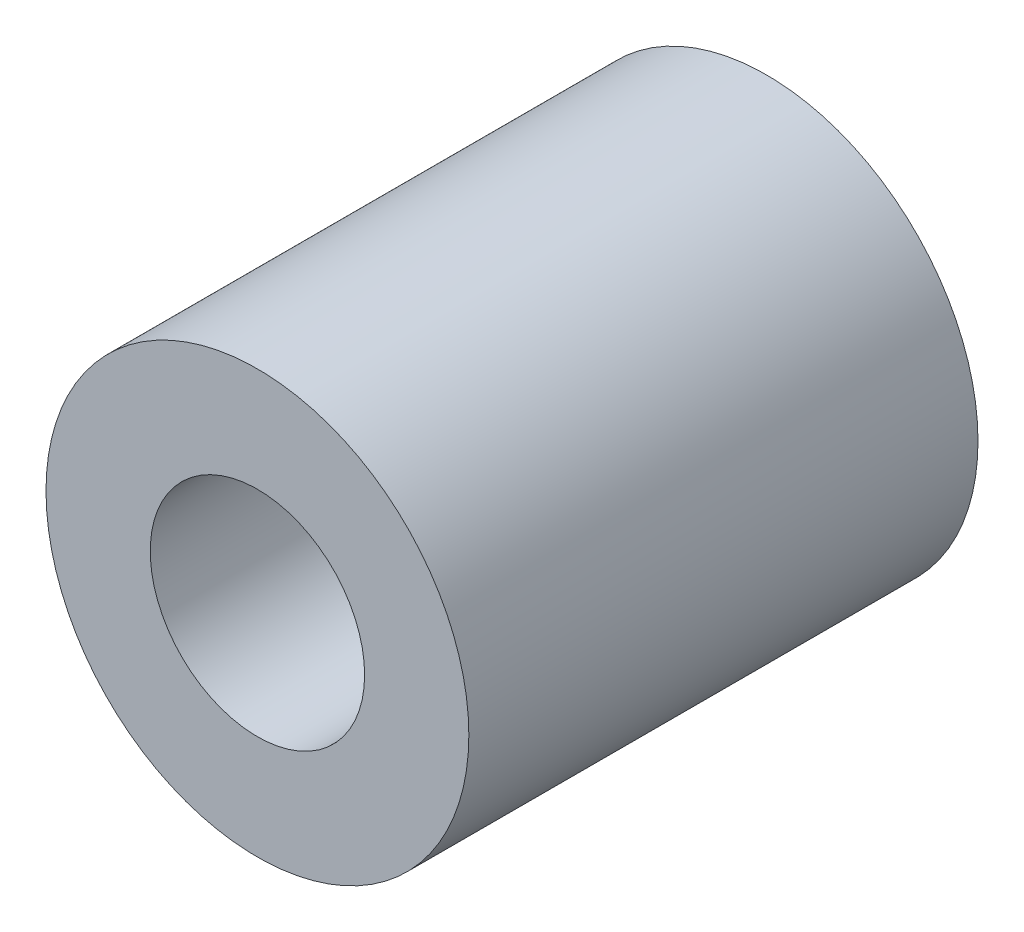
from build123d import *

# Parameters (mm, degrees)
ESQUISSE1_R        = 7.89
ESQUISSE1_R_2      = 4
BOSS_EXTRU_1_DEPTH = 19


with BuildPart() as part:
    # Esquisse1 → Boss.-Extru.1 (new body)
    with BuildSketch(Plane(origin=(0, 0, 0), x_dir=(0, 1, 0), z_dir=(0, 0, 1))):
        with Locations(Location((0, 0, 0), (0, 0, 270))):
            Circle(ESQUISSE1_R)
        with Locations(Location((0, 0, 0), (0, 0, 270))):
            Circle(ESQUISSE1_R_2, mode=Mode.SUBTRACT)
    extrude(amount=BOSS_EXTRU_1_DEPTH)


solid = part.part
